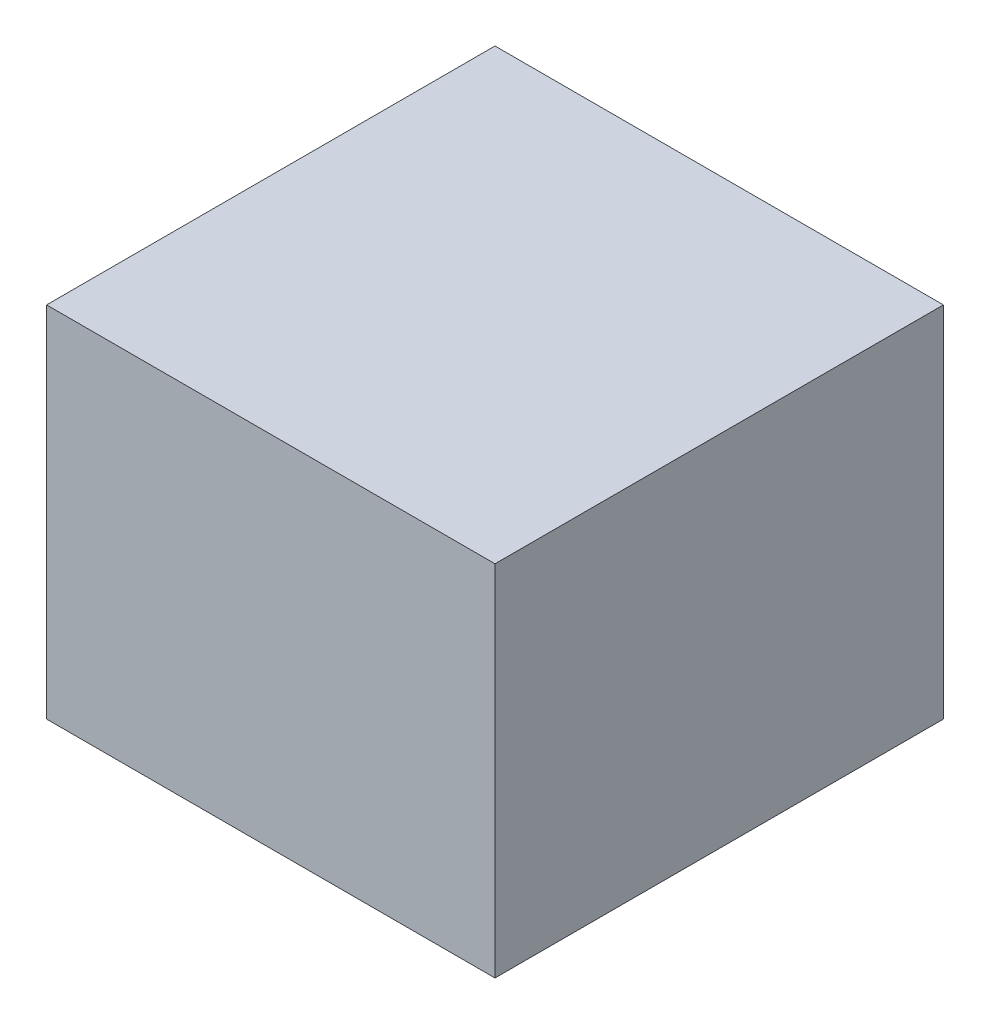
from build123d import *

# Parameters (mm, degrees)
SKETCH1_W           = 17.5
SKETCH1_H           = 17.5
BOSS_EXTRUDE1_DEPTH = 14


with BuildPart() as part:
    # Sketch1 → Boss-Extrude1 (new body)
    with BuildSketch(Plane(origin=(0, 0, 0), x_dir=(1, 0, 0), z_dir=(0, 1, 0))):
        Rectangle(SKETCH1_W, SKETCH1_H)
    extrude(amount=BOSS_EXTRUDE1_DEPTH)


solid = part.part
